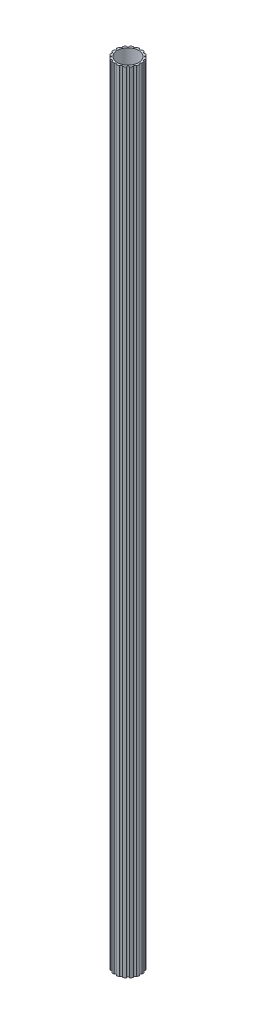
from build123d import *

# Parameters (mm, degrees)
SKETCH1_R           = 17.4625
SKETCH1_R_2         = 14.4145
BOSS_EXTRUDE1_DEPTH = 1070
SKETCH2_R           = 1.5
CUT_EXTRUDE2_DEPTH  = 1070
CIRPATTERN1_COUNT   = 16


with BuildPart() as part:
    # Sketch1 → Boss-Extrude1 (new body)
    with BuildSketch(Plane(origin=(0, 0, 0), x_dir=(1, 0, 0), z_dir=(0, 1, 0))):
        Circle(SKETCH1_R)
        Circle(SKETCH1_R_2, mode=Mode.SUBTRACT)
    extrude(amount=BOSS_EXTRUDE1_DEPTH)

    # Sketch2 → Cut-Extrude2 (cut, symmetric)
    with BuildSketch(Plane(origin=(0, 0, 0), x_dir=(1, 0, 0), z_dir=(0, 1, 0))):
        with Locations((17.4625, 0)):
            Circle(SKETCH2_R)
    cut_extrude2 = extrude(amount=CUT_EXTRUDE2_DEPTH, both=True, mode=Mode.SUBTRACT)

    # CirPattern1: Cut-Extrude2 ×16 about axis
    cirpattern1_axis = Axis((0, 1123.5, 0), (0, -1, 0))
    for i in range(1, CIRPATTERN1_COUNT):
        add(cut_extrude2.rotate(cirpattern1_axis, i * 360 / CIRPATTERN1_COUNT), mode=Mode.SUBTRACT)


solid = part.part
